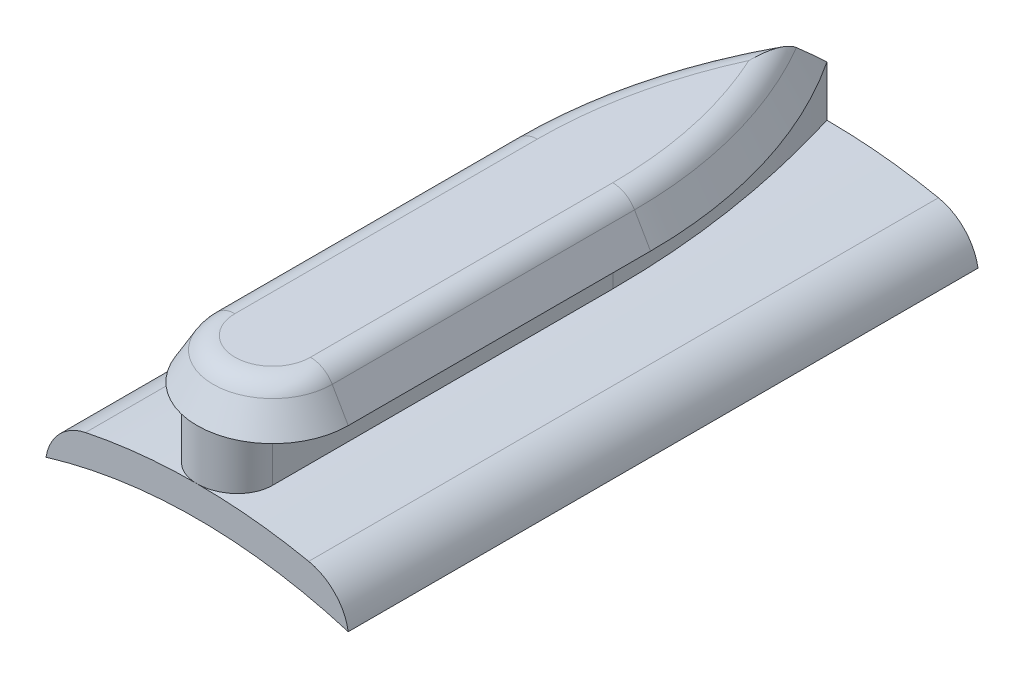
from build123d import *

# Parameters (mm, degrees)
BOSS_EXTRUDE1_DEPTH                  = 50
BOSS_EXTRUDE2_DEPTH                  = 4
BOSS_EXTRUDE2_DIRECTION_2_REACH      = 53.589
BOSS_EXTRUDE2_DIRECTION_2_END_RADIUS = 43.9
BOSS_EXTRUDE3_DEPTH                  = 3.2
BOSS_EXTRUDE3_DRAFT                  = 30
FILLET1_R                            = 2
CUT_EXTRUDE1_DEPTH                   = 0.2
CUT_EXTRUDE1_DEPTH_BACK              = 53.308316852


with BuildPart() as part:
    # Sketch1 → Boss-Extrude1 (new body)
    with BuildSketch(Plane.XY):
        with BuildLine():
            ThreePointArc((12, -1.772805284), (0, 0), (-12, -1.772805284))
            ThreePointArc((-12, -1.772805284), (-10.937910054, 0.34958038), (-8.860190701, 1.496593129))
            ThreePointArc((-8.860190701, 1.496593129), (0, 2.4), (8.860190701, 1.496593129))
            ThreePointArc((8.860190701, 1.496593129), (10.937910054, 0.34958038), (12, -1.772805284))
        make_face()
    extrude(amount=BOSS_EXTRUDE1_DEPTH)

    # Sketch2 → Boss-Extrude2 (add)
    with BuildSketch(Plane(origin=(0, 2.4, 0), x_dir=(1, 0, 0), z_dir=(0, 1, 0))):
        with BuildLine():
            Line((-3, -20), (-3, -47))
            ThreePointArc((-3, -47), (0, -50), (3, -47))
            Line((3, -47), (3, -20))
            ThreePointArc((3, -20), (2.245828054, -9.888125792), (0, 0))
            ThreePointArc((0, 0), (-2.245828054, -9.888125792), (-3, -20))
        make_face()
    extrude(amount=BOSS_EXTRUDE2_DEPTH)

    # Boss-Extrude2 direction 2: up to this cylinder (the profile starts outside it)
    boss_extrude2_direction_2_end = Plane(origin=(0, -41.5, 27.728009), z_dir=(0, 0, -1)) * Cylinder(BOSS_EXTRUDE2_DIRECTION_2_END_RADIUS, 195.978, mode=Mode.PRIVATE)
    # Sketch2 → Boss-Extrude2 direction 2 (add, up to the surface)
    with BuildSketch(Plane(origin=(0, 2.4, 0), x_dir=(1, 0, 0), z_dir=(0, 1, 0)), mode=Mode.PRIVATE) as boss_extrude2_direction_2_sk1:
        with BuildLine():
            Line((-3, -20), (-3, -47))
            ThreePointArc((-3, -47), (0, -50), (3, -47))
            Line((3, -47), (3, -20))
            ThreePointArc((3, -20), (2.245828054, -9.888125792), (0, 0))
            ThreePointArc((0, 0), (-2.245828054, -9.888125792), (-3, -20))
        make_face()
    boss_extrude2_direction_2_tool1 = extrude(boss_extrude2_direction_2_sk1.sketch, amount=-BOSS_EXTRUDE2_DIRECTION_2_REACH, mode=Mode.PRIVATE) - boss_extrude2_direction_2_end
    add(boss_extrude2_direction_2_tool1.solids().sort_by_distance((0, 2.4, 27.728009))[0])
    add(boss_extrude2_direction_2_tool1.solids().sort_by_distance((0, 2.4, 27.728009))[1])


with BuildPart() as boss_extrude3_tool:
    # Sketch3 → Boss-Extrude3 (with draft: the straight prism first)
    with BuildSketch(Plane(origin=(0, 6.4, 0), x_dir=(1, 0, 0), z_dir=(0, 1, 0))):
        with BuildLine():
            Line((-6, -20), (-6, -44))
            ThreePointArc((-6, -44), (0, -50), (6, -44))
            Line((6, -44), (6, -20))
            ThreePointArc((6, -20), (4.467688363, -9.559693491), (0, 0))
            ThreePointArc((0, 0), (-4.467688363, -9.559693491), (-6, -20))
        make_face()
    extrude(amount=BOSS_EXTRUDE3_DEPTH)
    # Boss-Extrude3: the draft: its side faces are tilted about the plane it starts from
    boss_extrude3_sides = [boss_extrude3_tool.faces().sort_by_distance(p)[0] for p in [
        (-6, 8, 32),
        (0, 8, 50),
        (6, 8, 32),
        (4.467688363, 8, 9.559693491),
        (-4.467688363, 8, 9.559693491),
    ]]
    draft(boss_extrude3_sides, Plane(origin=(0, 6.4, 0), x_dir=(1, 0, 0), z_dir=(0, 1, 0)), BOSS_EXTRUDE3_DRAFT)


with BuildPart() as part_1:
    add(part.part)

    # Boss-Extrude3: add boss_extrude3_tool
    add(boss_extrude3_tool.part)

    # Fillet1
    fillet1_edges = [part_1.edges().sort_by_distance(p)[0] for p in [
        (-3.098245352, 9.6, 11.538273909),
        (-4.152479139, 9.6, 32),
        (3.098245352, 9.6, 11.538273909),
        (4.152479139, 9.6, 32),
        (0, 9.6, 48.152479139),
    ]]
    fillet(fillet1_edges, radius=FILLET1_R)

    # Sketch4 → Cut-Extrude1 (cut, two sides: drawn at the far end of the back side and taken through both)
    # profile 1 of 4: a face of its own
    with BuildSketch(Plane(origin=(0, 0, 0), x_dir=(1, 0, 0), z_dir=(0, 1, 0)).offset(-CUT_EXTRUDE1_DEPTH_BACK)):
        with BuildLine():
            Line((0.717948718, -43.358974359), (0.717948718, -42.948717949))
            add(Edge.make_bspline(
                [(0.717948718, -42.948717949), (0.570093539, -43.021714387), (0.276866609, -43.16648119), (-0.143635062, -43.413861306), (-0.545610641, -43.679927311), (-0.7976821, -43.876548367), (-0.923076923, -43.974358974)],
                knots=[0, 0, 0, 0, 1.019914214, 2.022697593, 3.01637621, 4, 4, 4, 4], degree=3))
            Line((-0.923076923, -43.974358974), (-0.923076923, -35.358974359))
            Line((-0.923076923, -35.358974359), (-1.435897436, -35.358974359))
            Line((-1.435897436, -35.358974359), (-1.435897436, -43.974358974))
            add(Edge.make_bspline(
                [(-1.435897436, -43.974358974), (-1.483455619, -43.929963008), (-1.581830553, -43.838129174), (-1.744171554, -43.707945999), (-1.92260173, -43.576912712), (-2.120329227, -43.450307686), (-2.333632072, -43.32079121), (-2.565905649, -43.195528502), (-2.814965514, -43.069984687), (-2.988005243, -42.989880248), (-3.076923077, -42.948717949)],
                knots=[0, 0, 0, 0, 0.802826809, 1.660661296, 2.566734236, 3.5342345, 4.557641891, 5.64644632, 6.790607818, 8, 8, 8, 8], degree=3))
            Line((-3.076923077, -42.948717949), (-3.076923077, -43.370192308))
            add(Edge.make_bspline(
                [(-3.076923077, -43.370192308), (-2.969258793, -43.469224772), (-2.759551448, -43.66211915), (-2.467035488, -43.958128608), (-2.197928814, -44.245216836), (-1.9593142, -44.529501676), (-1.746305031, -44.806761874), (-1.561617176, -45.079595586), (-1.402768511, -45.346597948), (-1.31605478, -45.527655089), (-1.274038462, -45.615384615)],
                knots=[0, 0, 0, 0, 1.211045313, 2.358861152, 3.44488303, 4.468218803, 5.430702283, 6.338500846, 7.194936286, 8, 8, 8, 8], degree=3))
            Line((-1.274038462, -45.615384615), (-1.044871795, -45.615384615))
            add(Edge.make_bspline(
                [(-1.044871795, -45.615384615), (-1.00941504, -45.532444057), (-0.93559103, -45.35975469), (-0.791421436, -45.103076708), (-0.618814823, -44.835399241), (-0.410743665, -44.56005638), (-0.176441606, -44.271221692), (0.093419042, -43.975136359), (0.392414374, -43.667459637), (0.607148, -43.46397216), (0.717948718, -43.358974359)],
                knots=[0, 0, 0, 0, 0.750003825, 1.561572376, 2.445478363, 3.398371425, 4.43125038, 5.538922207, 6.730104867, 8, 8, 8, 8], degree=3))
        make_face()
    # profile 2 of 4: a face of its own
    with BuildSketch(Plane(origin=(0, 0, 0), x_dir=(1, 0, 0), z_dir=(0, 1, 0)).offset(-CUT_EXTRUDE1_DEPTH_BACK)):
        with BuildLine():
            Line((4, -30.846153846), (4, -30.128205128))
            Line((4, -30.128205128), (-0.793269231, -30.128205128))
            add(Edge.make_bspline(
                [(-0.793269231, -30.128205128), (-0.861110912, -30.128311972), (-0.989852195, -30.128514725), (-1.173094024, -30.127160408), (-1.336002502, -30.123367566), (-1.479205582, -30.120976344), (-1.602046148, -30.115656724), (-1.705189715, -30.111318331), (-1.788147892, -30.105739916), (-1.836561438, -30.099035648), (-1.857371795, -30.096153846)],
                knots=[0, 0, 0, 0, 1.528628734, 2.90083645, 4.128790002, 5.200304208, 6.127813768, 6.898992206, 7.526736466, 8, 8, 8, 8], degree=3))
            add(Edge.make_bspline(
                [(-1.857371795, -30.096153846), (-1.932456614, -30.084331142), (-2.07839549, -30.0613519), (-2.286096891, -30.002574457), (-2.473928, -29.921147675), (-2.645634876, -29.822006034), (-2.79866478, -29.694507522), (-2.940738595, -29.542758942), (-3.063480317, -29.357190079), (-3.176402094, -29.150983327), (-3.26703172, -28.928588309), (-3.335596652, -28.70137002), (-3.37737479, -28.472698456), (-3.382212882, -28.319610327), (-3.384615385, -28.243589744)],
                knots=[0, 0, 0, 0, 1.035924841, 2.013479024, 2.933602255, 3.82183108, 4.706948133, 5.639927629, 6.646101806, 7.731477349, 8.84205456, 9.913728764, 10.963998332, 12, 12, 12, 12], degree=3))
            add(Edge.make_bspline(
                [(-3.384615385, -28.243589744), (-3.382161005, -28.178323933), (-3.377266423, -28.04816927), (-3.34695256, -27.854784906), (-3.292330409, -27.666435069), (-3.221810264, -27.482230486), (-3.12878133, -27.309447904), (-3.0205733, -27.148210975), (-2.895500507, -27.002767788), (-2.755111685, -26.871605237), (-2.59815708, -26.756766275), (-2.425109595, -26.659871894), (-2.236538089, -26.578208502), (-2.103568059, -26.538188149), (-2.03525641, -26.517628205)],
                knots=[0, 0, 0, 0, 0.994510594, 1.983277156, 2.972612928, 3.9776239, 4.982470102, 5.955333794, 6.930747147, 7.898149105, 8.876444039, 9.885893618, 10.913904934, 12, 12, 12, 12], degree=3))
            add(Edge.make_bspline(
                [(-2.03525641, -26.517628205), (-2.007031097, -26.510770776), (-1.944133726, -26.49548966), (-1.837799347, -26.4812107), (-1.712337944, -26.466338642), (-1.566848086, -26.456019625), (-1.401817292, -26.445959692), (-1.216385846, -26.43994124), (-1.011227078, -26.437159451), (-0.868056423, -26.436330467), (-0.793269231, -26.435897436)],
                knots=[0, 0, 0, 0, 0.558680831, 1.244966039, 2.062412453, 2.990489873, 4.051219941, 5.244515665, 6.560634259, 8, 8, 8, 8], degree=3))
            Line((-0.793269231, -26.435897436), (4, -26.435897436))
            Line((4, -26.435897436), (4, -25.717948718))
            Line((4, -25.717948718), (-0.831730769, -25.717948718))
            add(Edge.make_bspline(
                [(-0.831730769, -25.717948718), (-0.918813715, -25.718523148), (-1.088761379, -25.719644182), (-1.337780041, -25.729563215), (-1.574061409, -25.744921436), (-1.797304002, -25.768139735), (-2.00777367, -25.793771901), (-2.205162918, -25.830446344), (-2.390795289, -25.868785373), (-2.564352955, -25.917279835), (-2.728132261, -25.975780148), (-2.886453023, -26.044272928), (-3.038021026, -26.128083575), (-3.185025312, -26.223722983), (-3.327667273, -26.32990885), (-3.462597096, -26.45230103), (-3.594238455, -26.584562892), (-3.7182474, -26.729480484), (-3.832782812, -26.884463964), (-3.931306175, -27.049788636), (-4.01781533, -27.222125513), (-4.086149203, -27.403320469), (-4.13903991, -27.592193299), (-4.177963753, -27.788734243), (-4.200169401, -27.993611665), (-4.203461257, -28.132961124), (-4.205128205, -28.203525641)],
                knots=[0, 0, 0, 0, 1.316364231, 2.568964831, 3.766826305, 4.894964518, 5.961692026, 6.970710131, 7.928946231, 8.826316495, 9.692177228, 10.556379512, 11.43093279, 12.306715499, 13.20629939, 14.115652445, 15.057829886, 16.025681089, 16.996391533, 17.967202739, 18.931442607, 19.907779629, 20.889445314, 21.893507297, 22.933303057, 24, 24, 24, 24], degree=3))
            add(Edge.make_bspline(
                [(-4.205128205, -28.203525641), (-4.203334456, -28.28048359), (-4.199815126, -28.43147481), (-4.17964884, -28.653961821), (-4.141663939, -28.867251413), (-4.093298354, -29.073596274), (-4.026592668, -29.270187125), (-3.948654097, -29.459657855), (-3.852934645, -29.638763412), (-3.746435461, -29.81040942), (-3.626607717, -29.970008863), (-3.496001605, -30.116517213), (-3.356709314, -30.250176345), (-3.207222763, -30.368733366), (-3.048704576, -30.47415253), (-2.880706313, -30.564964447), (-2.703293019, -30.642937576), (-2.579971418, -30.683181158), (-2.517628205, -30.703525641)],
                knots=[0, 0, 0, 0, 1.13879206, 2.234305948, 3.301075583, 4.341971843, 5.366689343, 6.369221514, 7.369726634, 8.367512178, 9.355451585, 10.318319045, 11.268648973, 12.207971039, 13.137398894, 14.081662264, 15.030215811, 16, 16, 16, 16], degree=3))
            add(Edge.make_bspline(
                [(-2.517628205, -30.703525641), (-2.475039464, -30.715359145), (-2.382663535, -30.74102628), (-2.229780132, -30.768512675), (-2.053746035, -30.791619147), (-1.854549193, -30.813346137), (-1.632035212, -30.826166612), (-1.386300547, -30.837406472), (-1.117048063, -30.84623303), (-0.929494885, -30.846180978), (-0.831730769, -30.846153846)],
                knots=[0, 0, 0, 0, 0.625038921, 1.35572334, 2.194682327, 3.136881307, 4.189498639, 5.346923369, 6.617055217, 8, 8, 8, 8], degree=3))
            Line((-0.831730769, -30.846153846), (4, -30.846153846))
        make_face()
    # profile 3 of 4: a face of its own
    with BuildSketch(Plane(origin=(0, 0, 0), x_dir=(1, 0, 0), z_dir=(0, 1, 0)).offset(-CUT_EXTRUDE1_DEPTH_BACK)):
        with BuildLine():
            Line((4, -23.564102564), (4, -21.995192308))
            add(Edge.make_bspline(
                [(4, -21.995192308), (3.99988138, -21.887281665), (3.999654099, -21.680520081), (3.992763251, -21.384028526), (3.983559384, -21.114749139), (3.970800771, -20.873262554), (3.95572285, -20.658825758), (3.934575331, -20.472409074), (3.912494656, -20.312547231), (3.890045727, -20.216761061), (3.879807692, -20.173076923)],
                knots=[0, 0, 0, 0, 1.415646017, 2.712440637, 3.8905458, 4.950247383, 5.884950622, 6.709939814, 7.411656543, 8, 8, 8, 8], degree=3))
            add(Edge.make_bspline(
                [(3.879807692, -20.173076923), (3.864671942, -20.117777287), (3.834757096, -20.008481081), (3.77483806, -19.850994871), (3.703800364, -19.701150498), (3.622804546, -19.558475714), (3.528536668, -19.424569411), (3.423978692, -19.297717501), (3.309188142, -19.177192396), (3.18193972, -19.067088299), (3.046925036, -18.965723342), (2.901137241, -18.878767586), (2.74774935, -18.805214496), (2.585190483, -18.745144024), (2.414448631, -18.699467293), (2.235025344, -18.665719882), (2.047537137, -18.64412787), (1.919397566, -18.642072136), (1.854166667, -18.641025641)],
                knots=[0, 0, 0, 0, 0.999487232, 1.975422798, 2.933948774, 3.889618007, 4.832992075, 5.786114792, 6.754729845, 7.731954186, 8.717668599, 9.695514499, 10.68728626, 11.680675814, 12.71351902, 13.766008651, 14.862761406, 16, 16, 16, 16], degree=3))
            add(Edge.make_bspline(
                [(1.854166667, -18.641025641), (1.788388891, -18.641988898), (1.659690231, -18.643873574), (1.471409572, -18.666493655), (1.291481823, -18.696962664), (1.120305936, -18.743813069), (0.958898461, -18.805174608), (0.804792788, -18.877156443), (0.660610681, -18.963975941), (0.525828698, -19.063735552), (0.400320327, -19.174710625), (0.284995082, -19.296431626), (0.180528023, -19.428407152), (0.086684952, -19.570217776), (0.005642027, -19.723246002), (-0.066946099, -19.885170924), (-0.127908523, -20.057399991), (-0.159977235, -20.17658288), (-0.176282051, -20.237179487)],
                knots=[0, 0, 0, 0, 1.121902311, 2.195077645, 3.232258892, 4.234102512, 5.217864754, 6.176164875, 7.132989551, 8.084763148, 9.034132444, 9.988522005, 10.94243251, 11.903244335, 12.886203696, 13.894208494, 14.929344452, 16, 16, 16, 16], degree=3))
            add(Edge.make_bspline(
                [(-0.176282051, -20.237179487), (-0.186940294, -20.287299108), (-0.210298452, -20.39713917), (-0.236374925, -20.578036821), (-0.258632298, -20.788654846), (-0.275320612, -21.028705771), (-0.289607169, -21.297974126), (-0.300962812, -21.596605571), (-0.307202478, -21.925186319), (-0.30752429, -22.154377734), (-0.307692308, -22.274038462)],
                knots=[0, 0, 0, 0, 0.601384939, 1.31797006, 2.144135048, 3.087295005, 4.142315834, 5.309527816, 6.595305764, 8, 8, 8, 8], degree=3))
            Line((-0.307692308, -22.274038462), (-0.307692308, -22.846153846))
            Line((-0.307692308, -22.846153846), (-4, -22.846153846))
            Line((-4, -22.846153846), (-4, -23.564102564))
            Line((-4, -23.564102564), (4, -23.564102564))
        make_face()
        with BuildLine():
            Line((3.179487179, -22.846153846), (0.512820513, -22.846153846))
            Line((0.512820513, -22.846153846), (0.495192308, -21.445512821))
            add(Edge.make_bspline(
                [(0.495192308, -21.445512821), (0.495149541, -21.37712375), (0.49506698, -21.245100059), (0.504301049, -21.05386502), (0.514486846, -20.876898166), (0.530438241, -20.713815191), (0.551455704, -20.565862382), (0.57433281, -20.431139337), (0.605326736, -20.31161833), (0.648542837, -20.171561595), (0.72081222, -20.016025375), (0.828416055, -19.847941875), (0.961810487, -19.703187722), (1.113852964, -19.578760661), (1.283608966, -19.482330017), (1.463812883, -19.409801879), (1.654578108, -19.367554655), (1.785055357, -19.361853902), (1.850961538, -19.358974359)],
                knots=[0, 0, 0, 0, 1.160368111, 2.240066715, 3.248291599, 4.168343349, 5.019594299, 5.784185847, 6.485545725, 7.113397927, 8.269509094, 9.383373363, 10.487084095, 11.595623793, 12.704274681, 13.786671823, 14.88201193, 16, 16, 16, 16], degree=3))
            add(Edge.make_bspline(
                [(1.850961538, -19.358974359), (1.915273143, -19.361869278), (2.043116652, -19.36762402), (2.230570416, -19.410135121), (2.408862438, -19.482188435), (2.576528531, -19.579414089), (2.727948773, -19.700268454), (2.858332698, -19.841814719), (2.9645727, -20.001162604), (3.032671419, -20.14946703), (3.074319744, -20.281115192), (3.103447557, -20.395476792), (3.126707115, -20.524597436), (3.145539946, -20.668524066), (3.161662241, -20.826139601), (3.172601588, -20.998798633), (3.179004926, -21.185846952), (3.179322536, -21.315699687), (3.179487179, -21.383012821)],
                knots=[0, 0, 0, 0, 1.120550889, 2.227516482, 3.330715807, 4.461473166, 5.594337325, 6.694900473, 7.802844763, 8.919519911, 9.52614448, 10.208195984, 10.975273469, 11.811520316, 12.738076669, 13.736566072, 14.826679847, 16, 16, 16, 16], degree=3))
            Line((3.179487179, -21.383012821), (3.179487179, -22.846153846))
        make_face(mode=Mode.SUBTRACT)
    # profile 4 of 4: a face of its own
    with BuildSketch(Plane(origin=(0, 0, 0), x_dir=(1, 0, 0), z_dir=(0, 1, 0)).offset(-CUT_EXTRUDE1_DEPTH_BACK)):
        with BuildLine():
            Line((0.717948718, -12.282051282), (0.717948718, -11.871794872))
            add(Edge.make_bspline(
                [(0.717948718, -11.871794872), (0.570093539, -11.94479131), (0.276866609, -12.089558113), (-0.143635062, -12.336938229), (-0.545610641, -12.603004234), (-0.7976821, -12.79962529), (-0.923076923, -12.897435897)],
                knots=[0, 0, 0, 0, 1.019914214, 2.022697593, 3.01637621, 4, 4, 4, 4], degree=3))
            Line((-0.923076923, -12.897435897), (-0.923076923, -4.282051282))
            Line((-0.923076923, -4.282051282), (-1.435897436, -4.282051282))
            Line((-1.435897436, -4.282051282), (-1.435897436, -12.897435897))
            add(Edge.make_bspline(
                [(-1.435897436, -12.897435897), (-1.483455619, -12.853039931), (-1.581830553, -12.761206097), (-1.744171554, -12.631022922), (-1.92260173, -12.499989635), (-2.120329227, -12.373384609), (-2.333632072, -12.243868133), (-2.565905649, -12.118605425), (-2.814965514, -11.99306161), (-2.988005243, -11.912957172), (-3.076923077, -11.871794872)],
                knots=[0, 0, 0, 0, 0.802826809, 1.660661296, 2.566734236, 3.5342345, 4.557641891, 5.64644632, 6.790607818, 8, 8, 8, 8], degree=3))
            Line((-3.076923077, -11.871794872), (-3.076923077, -12.293269231))
            add(Edge.make_bspline(
                [(-3.076923077, -12.293269231), (-2.969258793, -12.392301695), (-2.759551448, -12.585196073), (-2.467035488, -12.881205531), (-2.197928814, -13.168293759), (-1.9593142, -13.452578599), (-1.746305031, -13.729838797), (-1.561617176, -14.00267251), (-1.402768511, -14.269674871), (-1.31605478, -14.450732012), (-1.274038462, -14.538461538)],
                knots=[0, 0, 0, 0, 1.211045313, 2.358861152, 3.44488303, 4.468218803, 5.430702283, 6.338500846, 7.194936286, 8, 8, 8, 8], degree=3))
            Line((-1.274038462, -14.538461538), (-1.044871795, -14.538461538))
            add(Edge.make_bspline(
                [(-1.044871795, -14.538461538), (-1.00941504, -14.45552098), (-0.93559103, -14.282831613), (-0.791421436, -14.026153631), (-0.618814823, -13.758476165), (-0.410743665, -13.483133303), (-0.176441606, -13.194298615), (0.093419042, -12.898213282), (0.392414374, -12.59053656), (0.607148, -12.387049083), (0.717948718, -12.282051282)],
                knots=[0, 0, 0, 0, 0.750003825, 1.561572376, 2.445478363, 3.398371425, 4.43125038, 5.538922207, 6.730104867, 8, 8, 8, 8], degree=3))
        make_face()
    extrude(amount=CUT_EXTRUDE1_DEPTH + CUT_EXTRUDE1_DEPTH_BACK, mode=Mode.SUBTRACT)


solid = part_1.part
